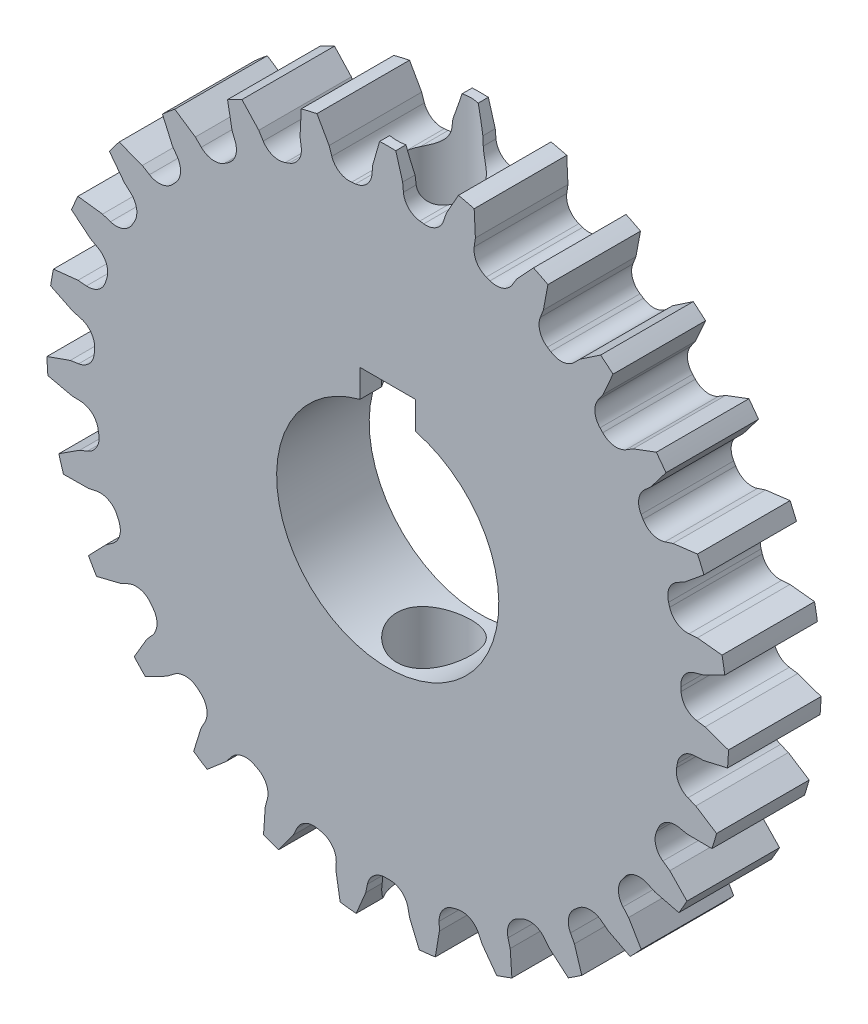
from build123d import *

# Parameters (mm, degrees)
SKETCH1_R               = 7.9325
BOSS_EXTRUDE1_DEPTH     = 1.25
CIRPATTERN1_COUNT       = 27
FILLET1_R               = 0.5
FILLET2_R               = 0.5
CUT_EXTRUDE1_DEPTH      = 14.255386098
CUT_EXTRUDE2_DEPTH      = 14.077375907
CUT_EXTRUDE2_DEPTH_BACK = 14.077375907
SKETCH4_R               = 1


with BuildPart() as part:
    # Sketch1 → Boss-Extrude1 (new, symmetric)
    with BuildSketch(Plane.XY):
        Circle(SKETCH1_R)
        with BuildLine():
            ThreePointArc((0.218015406, 9.204918551), (0, 9.2075), (-0.218015406, 9.204918551))
            Line((-0.218015406, 9.204918551), (-0.403459821, 8.563000433))
            Line((-0.403459821, 8.563000433), (-0.462798765, 7.918988165))
            ThreePointArc((-0.462798765, 7.918988165), (0, 7.9325), (0.462798765, 7.918988165))
            Line((0.462798765, 7.918988165), (0.403459821, 8.563000433))
            Line((0.403459821, 8.563000433), (0.218015406, 9.204918551))
        make_face()
    boss_extrude1 = extrude(amount=BOSS_EXTRUDE1_DEPTH, both=True)

    # CirPattern1: Boss-Extrude1 ×27 about axis
    cirpattern1_axis = Axis((0, 0, 0), (0, 0, 1))
    for i in range(1, CIRPATTERN1_COUNT):
        add(boss_extrude1.rotate(cirpattern1_axis, i * 360 / CIRPATTERN1_COUNT))

    # Fillet1
    fillet1_edges = [part.edges().sort_by_distance(p)[0] for p in [
        (-0.462798765, 7.918988165, 0),
        (0.462798765, 7.918988165, 0),
    ]]
    fillet(fillet1_edges, radius=FILLET1_R)

    # Fillet2
    fillet2_edges = [part.edges().sort_by_distance(p)[0] for p in [
        (-3.967607478, 6.868962596, 0),
        (-6.628368329, 4.357670197, 0),
        (-7.879045103, 0.919350052, 0),
        (-7.453575428, -2.714547768, 0),
        (-5.442471477, -5.770967031, 0),
        (-2.273564883, -7.599701242, 0),
        (1.379007898, -7.811715142, 0),
        (4.738217821, -6.361906014, 0),
        (7.089444305, -3.558698595, 0),
        (7.932499845, 0.00156757, 0),
        (7.088037257, 3.56150026, 0),
        (4.735703052, 6.36377819, 0),
        (1.375920387, 7.812259554, 0),
        (3.140463314, 7.284370009, 0),
        (6.075639812, 5.100113443, 0),
        (7.718316779, 1.830885675, 0),
        (7.719039792, -1.827835043, 0),
        (6.077655041, -5.097711786, 0),
        (3.143342051, -7.283128243, 0),
        (-0.459668928, -7.919170457, 0),
        (-3.964892367, -6.870530167, 0),
        (-6.626645541, -4.360289569, 0),
        (-7.878681135, -0.922463994, 0),
        (-7.45464771, 2.7116017, 0),
        (-5.444751896, 5.768815567, 0),
        (-2.276568315, 7.598802074, 0),
        (-1.375920387, 7.812259554, 0),
        (-4.735703052, 6.36377819, 0),
        (-7.088037257, 3.56150026, 0),
        (-7.932499845, 0.00156757, 0),
        (-7.089444305, -3.558698595, 0),
        (-4.738217821, -6.361906014, 0),
        (-1.379007898, -7.811715142, 0),
        (2.273564883, -7.599701242, 0),
        (5.442471477, -5.770967031, 0),
        (7.453575428, -2.714547768, 0),
        (7.879045103, 0.919350052, 0),
        (6.628368329, 4.357670197, 0),
        (3.967607478, 6.868962596, 0),
        (2.276568315, 7.598802074, 0),
        (5.444751896, 5.768815567, 0),
        (7.45464771, 2.7116017, 0),
        (7.878681135, -0.922463994, 0),
        (6.626645541, -4.360289569, 0),
        (3.964892367, -6.870530167, 0),
        (0.459668928, -7.919170457, 0),
        (-3.143342051, -7.283128243, 0),
        (-6.077655041, -5.097711786, 0),
        (-7.719039792, -1.827835043, 0),
        (-7.718316779, 1.830885675, 0),
        (-6.075639812, 5.100113443, 0),
        (-3.140463314, 7.284370009, 0),
    ]]
    fillet(fillet2_edges, radius=FILLET2_R)

    # Sketch3 → Cut-Extrude1 (cut, through all)
    with BuildSketch(Plane(origin=(0, 0, -1.25), x_dir=(-1, 0, 0), z_dir=(0, 0, -1))):
        with BuildLine():
            Line((0.75, 2.90473751), (0.75, 3.65473751))
            Line((0.75, 3.65473751), (-0.75, 3.65473751))
            Line((-0.75, 3.65473751), (-0.75, 2.90473751))
            ThreePointArc((-0.75, 2.90473751), (0, -3), (0.75, 2.90473751))
        make_face()
    extrude(amount=-CUT_EXTRUDE1_DEPTH, mode=Mode.SUBTRACT)

    # Sketch4 → Cut-Extrude2 (cut, two sides: drawn at the far end of the back side and taken through both)
    with BuildSketch(Plane(origin=(0, 0, 0), x_dir=(1, 0, 0), z_dir=(0, 1, 0)).offset(-CUT_EXTRUDE2_DEPTH_BACK)):
        with Locations(Location((0, 0, 0), (0, 0, 270))):
            Circle(SKETCH4_R)
    extrude(amount=CUT_EXTRUDE2_DEPTH + CUT_EXTRUDE2_DEPTH_BACK, mode=Mode.SUBTRACT)


solid = part.part
